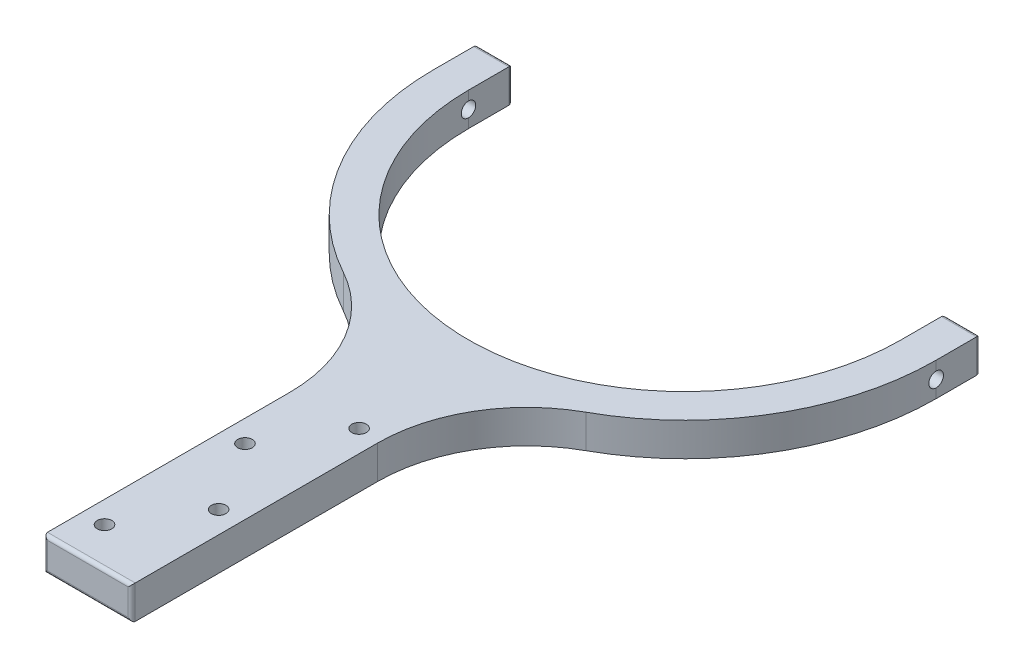
from build123d import *

# Parameters (mm, degrees)
RESSALTO_EXTRUS_O1_DEPTH                       = 19
FILETE2_R                                      = 2
FILETE3_R                                      = 2
FILETE4_R                                      = 2
FURO_ROSCADO_PARA_CONDU_TE_DE_M8X1_252_D       = 8.3
FURO_ROSCADO_PARA_CONDU_TE_DE_M8X1_251_D       = 8.3
FURO_ROSCADO_PARA_CONDU_TE_DE_M8X1_251_DEPTH   = 25
FURO_ROSCADO_PARA_CONDU_TE_DE_M8X1_251_TIP     = 2.493571569
FURO_ROSCADO_PARA_CONDU_TE_DE_M8X1_251_O_D     = 8.3
FURO_ROSCADO_PARA_CONDU_TE_DE_M8X1_251_O_DEPTH = 25
FURO_ROSCADO_PARA_CONDU_TE_DE_M8X1_251_O_TIP   = 2.493571569


with BuildPart() as part:
    # Esboço2 → Ressalto-extrusão1 (new body)
    with BuildSketch(Plane(origin=(0, 0, 0), x_dir=(1, 0, 0), z_dir=(0, 1, 0))):
        with BuildLine():
            Line((-25, -200), (-25, -340))
            Line((-25, -340), (25, -340))
            Line((25, -340), (25, -200))
            ThreePointArc((25, -200), (36.838728685, -156.699788653), (69.061196889, -125.446367362))
            ThreePointArc((69.061196889, -125.446367362), (123.279770024, -72.858344084), (143.2, 0))
            Line((143.2, 0), (143.2, 25))
            Line((143.2, 25), (123.2, 25))
            Line((123.2, 25), (123.2, 0))
            ThreePointArc((123.2, 0), (0, -123.2), (-123.2, 0))
            Line((-123.2, 0), (-123.2, 25))
            Line((-123.2, 25), (-143.2, 25))
            Line((-143.2, 25), (-143.2, 0))
            ThreePointArc((-143.2, 0), (-123.279770024, -72.858344084), (-69.061196889, -125.446367362))
            ThreePointArc((-69.061196889, -125.446367362), (-36.838728685, -156.699788653), (-25, -200))
        make_face()
    extrude(amount=RESSALTO_EXTRUS_O1_DEPTH)

    # Filete2
    filete2_edges = [part.edges().sort_by_distance(p)[0] for p in [
        (-133.2, 19, -25),
        (-133.2, 0, -25),
        (-143.2, 9.5, -25),
        (-123.2, 9.5, -25),
    ]]
    fillet(filete2_edges, radius=FILETE2_R)

    # Filete3
    filete3_edges = [part.edges().sort_by_distance(p)[0] for p in [
        (133.2, 0, -25),
        (123.2, 9.5, -25),
        (143.2, 9.5, -25),
        (133.2, 19, -25),
    ]]
    fillet(filete3_edges, radius=FILETE3_R)

    # Filete4
    filete4_edges = [part.edges().sort_by_distance(p)[0] for p in [
        (0, 0, 340),
        (25, 9.5, 340),
        (-25, 9.5, 340),
        (0, 19, 340),
    ]]
    fillet(filete4_edges, radius=FILETE4_R)

    # Furo roscado para conduíte de M8x1.252 (through all)
    with Locations(Plane(origin=(-12.5, 19, 318), x_dir=(0, 0, 1), z_dir=(0, 1, 0))):
        with Locations((0, 0), (-40, 25), (-120, 25), (-80, 0)):
            Hole(FURO_ROSCADO_PARA_CONDU_TE_DE_M8X1_252_D / 2)

    # Furo roscado para conduíte de M8x1.251
    with Locations(Plane(origin=(143.2, 9.5, 0), x_dir=(0, 0, 1), z_dir=(1, 0, 0))):
        with Locations((0, 0)):
            Hole(FURO_ROSCADO_PARA_CONDU_TE_DE_M8X1_251_D / 2, depth=FURO_ROSCADO_PARA_CONDU_TE_DE_M8X1_251_DEPTH)
            with Locations((0, 0, -(FURO_ROSCADO_PARA_CONDU_TE_DE_M8X1_251_DEPTH + FURO_ROSCADO_PARA_CONDU_TE_DE_M8X1_251_TIP / 2))):  # 118° drill point
                Cone(0, FURO_ROSCADO_PARA_CONDU_TE_DE_M8X1_251_D / 2, FURO_ROSCADO_PARA_CONDU_TE_DE_M8X1_251_TIP, mode=Mode.SUBTRACT)

    # Furo roscado para conduíte de M8x1.251 o
    with Locations(Plane(origin=(-143.2, 9.5, 0), x_dir=(0, 0, -1), z_dir=(-1, 0, 0))):
        with Locations((0, 0)):
            Hole(FURO_ROSCADO_PARA_CONDU_TE_DE_M8X1_251_O_D / 2, depth=FURO_ROSCADO_PARA_CONDU_TE_DE_M8X1_251_O_DEPTH)
            with Locations((0, 0, -(FURO_ROSCADO_PARA_CONDU_TE_DE_M8X1_251_O_DEPTH + FURO_ROSCADO_PARA_CONDU_TE_DE_M8X1_251_O_TIP / 2))):  # 118° drill point
                Cone(0, FURO_ROSCADO_PARA_CONDU_TE_DE_M8X1_251_O_D / 2, FURO_ROSCADO_PARA_CONDU_TE_DE_M8X1_251_O_TIP, mode=Mode.SUBTRACT)


solid = part.part
